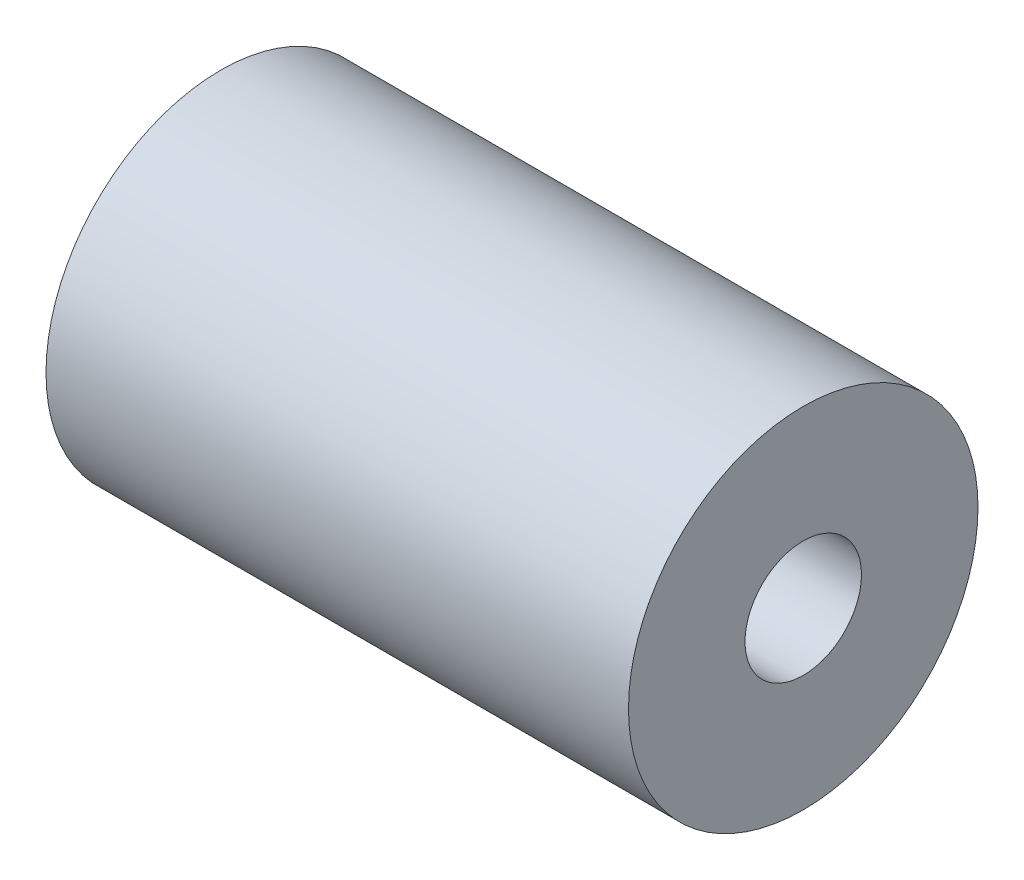
from build123d import *

# Parameters (mm, degrees)
SKETCH_1_R      = 3
SKETCH_1_R_2    = 1
EXTRUDE_1_DEPTH = 10


with BuildPart() as part:
    # 草图1 → 凸台-拉伸1 (new body)
    with BuildSketch(Plane(origin=(0, 0, 0), x_dir=(0, 0, -1), z_dir=(1, 0, 0))):
        Circle(SKETCH_1_R)
        Circle(SKETCH_1_R_2, mode=Mode.SUBTRACT)
    extrude(amount=EXTRUDE_1_DEPTH)


solid = part.part
